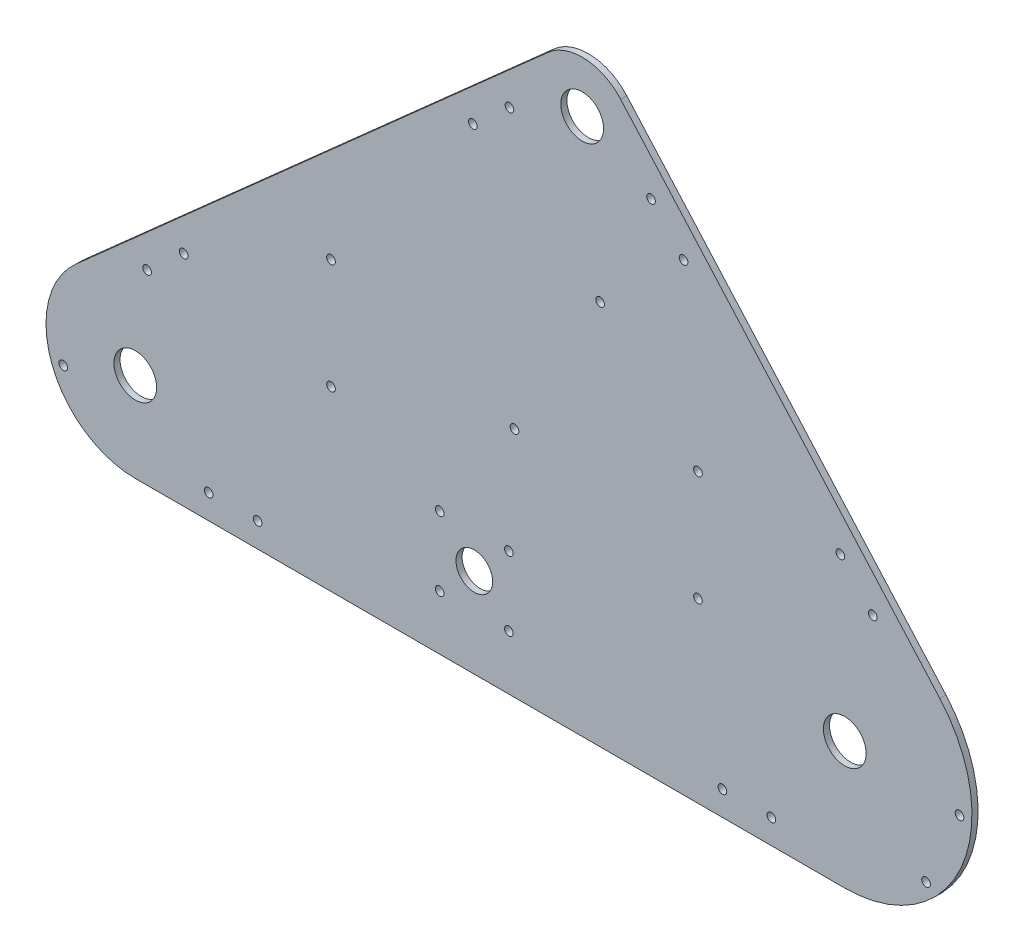
from build123d import *

# Parameters (mm, degrees)
SKETCH1_R                 = 11.0998
SKETCH1_R_2               = 9.525
BOSS_EXTRUDE1_DEPTH       = 3.175
F_8_CLEARANCE_HOLE1_D     = 4.4958
F_8_CLEARANCE_HOLE1_DEPTH = 12.7
F_8_CLEARANCE_HOLE1_TIP   = 1.350674586
F_8_CLEARANCE_HOLE2_D     = 4.4958


with BuildPart() as part:
    # Sketch1 → Boss-Extrude1 (new body)
    with BuildSketch(Plane.XY):
        with BuildLine():
            Line((-188.264639147, 81.011774484), (56.809800323, 298.704514086))
            ThreePointArc((56.809800323, 298.704514086), (76.096805757, 305.388436009), (94.461024604, 296.476710194))
            Line((94.461024604, 296.476710194), (260.194034881, 109.897568099))
            ThreePointArc((260.194034881, 109.897568099), (271.059668812, 38.975929697), (210.82, 0))
            Line((210.82, 0), (-157.48, 0))
            ThreePointArc((-157.48, 0), (-200.811863601, 29.88880366), (-188.264639147, 81.011774484))
        make_face()
        with Locations((-157.48, 46.355)):
            Circle(SKETCH1_R, mode=Mode.SUBTRACT)
        with Locations((74.521510517, 278.765)):
            Circle(SKETCH1_R, mode=Mode.SUBTRACT)
        with Locations((210.82, 66.04)):
            Circle(SKETCH1_R, mode=Mode.SUBTRACT)
        with Locations((18.5166, 46.355)):
            Circle(SKETCH1_R_2, mode=Mode.SUBTRACT)
    extrude(amount=BOSS_EXTRUDE1_DEPTH)

    # #8 Clearance Hole1
    with Locations(Plane.XY.offset(3.175)):
        with Locations((36.477112242, 64.315512242), (36.477112242, 28.394487758), (0.556087758, 28.394487758), (0.556087758, 64.315512242)):
            Hole(F_8_CLEARANCE_HOLE1_D / 2, depth=F_8_CLEARANCE_HOLE1_DEPTH)
            with Locations((0, 0, -(F_8_CLEARANCE_HOLE1_DEPTH + F_8_CLEARANCE_HOLE1_TIP / 2))):  # 118° drill point
                Cone(0, F_8_CLEARANCE_HOLE1_D / 2, F_8_CLEARANCE_HOLE1_TIP, mode=Mode.SUBTRACT)

    # #8 Clearance Hole2 (through all)
    with Locations(Plane.XY.offset(3.175)):
        with Locations((17.768914495, 247.038768822), (36.758927911, 263.907064244), (110.26846103, 259.557542359), (127.136756453, 240.567528943), (208.528289616, 148.938453927), (225.396585039, 129.948440511), (270.394698688, 62.514995218), (253.027203769, 23.832796231), (172.72, 12.7), (147.32, 12.7), (-93.98, 12.7), (-119.38, 12.7), (-194.875991874, 32.144446994), (-151.345471312, 96.81921091), (-132.355457896, 113.687506333), (-55.88, 149.225), (-55.88, 92.075), (134.62, 92.075), (134.62, 149.225), (83.82, 200.025), (39.37, 120.65)):
            Hole(F_8_CLEARANCE_HOLE2_D / 2)


solid = part.part
